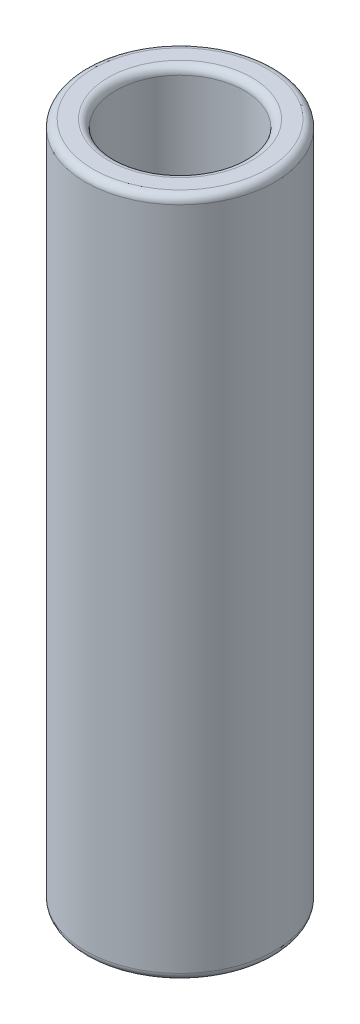
from build123d import *

# Parameters (mm, degrees)
SKETCH1_R           = 2.5
SKETCH1_R_2         = 1.7
BOSS_EXTRUDE1_DEPTH = 18
FILLET1_R           = 0.2


with BuildPart() as part:
    # Sketch1 → Boss-Extrude1 (new body)
    with BuildSketch(Plane(origin=(0, 0, 0), x_dir=(1, 0, 0), z_dir=(0, 1, 0))):
        with Locations(Location((0, 0, 0), (0, 0, 270))):
            Circle(SKETCH1_R)
        with Locations(Location((0, 0, 0), (0, 0, 270))):
            Circle(SKETCH1_R_2, mode=Mode.SUBTRACT)
    extrude(amount=BOSS_EXTRUDE1_DEPTH)

    # Fillet1
    fillet1_edges = [part.edges().sort_by_distance(p)[0] for p in [
        (0, 0, -2.5),
        (0, 18, -2.5),
        (0, 0, -1.7),
        (0, 18, -1.7),
    ]]
    fillet(fillet1_edges, radius=FILLET1_R)


solid = part.part
